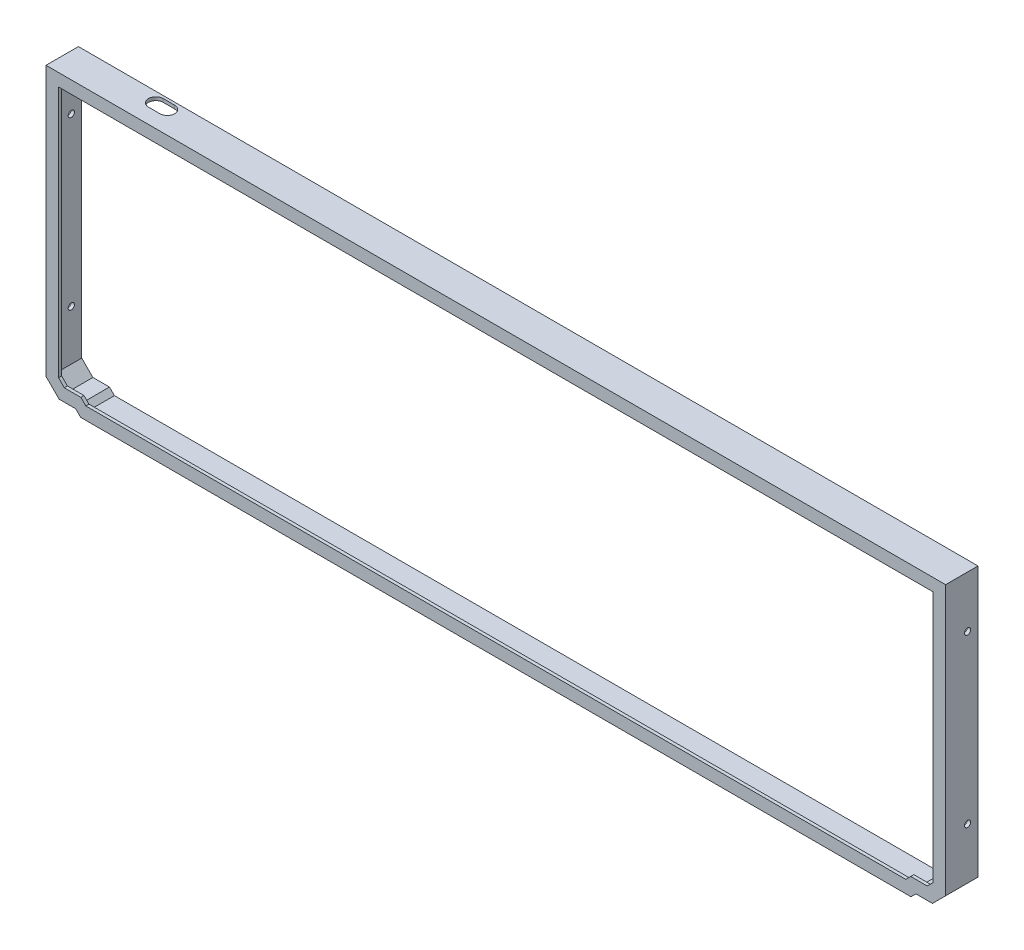
from build123d import *

# Parameters (mm, degrees)
P_IDAT_VYSUNUT_M1_DEPTH  = 14.05
P_IDAT_VYSUNUT_M2_DEPTH  = 1.5
ODEBRAT_VYSUNUT_M1_DEPTH = 1.6
ODEBRAT_VYSUNUT_M2_REACH = 454.909
SKICA4_R                 = 1.5


with BuildPart() as part:
    # Skica1 → Přidat vysunutím1 (new body)
    with BuildSketch(Plane.XY):
        Polygon((-1.7, 1.7), (429.98, 1.7), (429.98, -127.624163056), (423.673791129, -133.930371927), (415.733791129, -133.930371927), (413.350841277, -136.313321779), (14.929158723, -136.313321779), (12.546208871, -133.930371927), (4.606208871, -133.930371927), (-1.7, -127.624163056), align=None)
        Polygon((-0.1, 0.1), (428.38, 0.1), (428.38, -126.961421356), (423.01104943, -132.330371927), (415.07104943, -132.330371927), (412.688099577, -134.713321779), (15.591900423, -134.713321779), (13.20895057, -132.330371927), (5.26895057, -132.330371927), (-0.1, -126.961421356), align=None, mode=Mode.SUBTRACT)
    extrude(amount=-P_IDAT_VYSUNUT_M1_DEPTH)

    # Skica2 → Přidat vysunutím2 (add)
    with BuildSketch(Plane.XY):
        Polygon((-1.7, 1.7), (-1.7, -127.624163056), (4.606208871, -133.930371927), (12.546208871, -133.930371927), (14.929158723, -136.313321779), (413.350841277, -136.313321779), (415.733791129, -133.930371927), (423.673791129, -133.930371927), (429.98, -127.624163056), (429.98, 1.7), align=None)
        Polygon((4.3, -4.3), (4.3, -125.138881682), (7.091490245, -127.930371927), (15.031490245, -127.930371927), (17.414440098, -130.313321779), (410.865559902, -130.313321779), (413.248509755, -127.930371927), (421.188509755, -127.930371927), (423.98, -125.138881682), (423.98, -4.3), align=None, mode=Mode.SUBTRACT)
    extrude(amount=P_IDAT_VYSUNUT_M2_DEPTH)

    # Skica3 → Odebrat vysunutím1 (cut)
    with BuildSketch(Plane(origin=(0, 1.7, 0), x_dir=(1, 0, 0), z_dir=(0, 1, 0))):
        with BuildLine():
            Line((45.76, 5.7), (40.26, 5.7))
            ThreePointArc((40.26, 5.7), (36.71, 9.25), (40.26, 12.8))
            Line((40.26, 12.8), (45.76, 12.8))
            ThreePointArc((45.76, 12.8), (49.31, 9.25), (45.76, 5.7))
        make_face()
    extrude(amount=-ODEBRAT_VYSUNUT_M1_DEPTH, mode=Mode.SUBTRACT)

    # Odebrat vysunutím2: up to this face of the body (flat: up to its plane)
    odebrat_vysunut_m2_end = Plane(part.part.faces().sort_by_distance((429.98, -62.962081528, -6.275))[0])
    # Skica4 → Odebrat vysunutím2 (cut, up to the picked face)
    with BuildSketch(Plane.ZY.offset(1.7), mode=Mode.PRIVATE) as odebrat_vysunut_m2_sk1:
        with Locations(Location((-9.05, -22.962081528, 0), (0, 0, 180))):
            Circle(SKICA4_R)
    odebrat_vysunut_m2_tool1 = split(extrude(odebrat_vysunut_m2_sk1.sketch, amount=-ODEBRAT_VYSUNUT_M2_REACH, mode=Mode.PRIVATE), bisect_by=odebrat_vysunut_m2_end, keep=Keep.BOTH, mode=Mode.PRIVATE)
    # Skica4 → Odebrat vysunutím2 (cut, up to the picked face)
    with BuildSketch(Plane.ZY.offset(1.7), mode=Mode.PRIVATE) as odebrat_vysunut_m2_sk2:
        with Locations(Location((-9.05, -102.962081528, 0), (0, 0, 180))):
            Circle(SKICA4_R)
    odebrat_vysunut_m2_tool2 = split(extrude(odebrat_vysunut_m2_sk2.sketch, amount=-ODEBRAT_VYSUNUT_M2_REACH, mode=Mode.PRIVATE), bisect_by=odebrat_vysunut_m2_end, keep=Keep.BOTH, mode=Mode.PRIVATE)
    add(odebrat_vysunut_m2_tool1.solids().sort_by(Axis((-1.7, -22.962082, -9.05), (1, 0, 0)))[0], mode=Mode.SUBTRACT)
    add(odebrat_vysunut_m2_tool2.solids().sort_by(Axis((-1.7, -102.962082, -9.05), (1, 0, 0)))[0], mode=Mode.SUBTRACT)


solid = part.part
